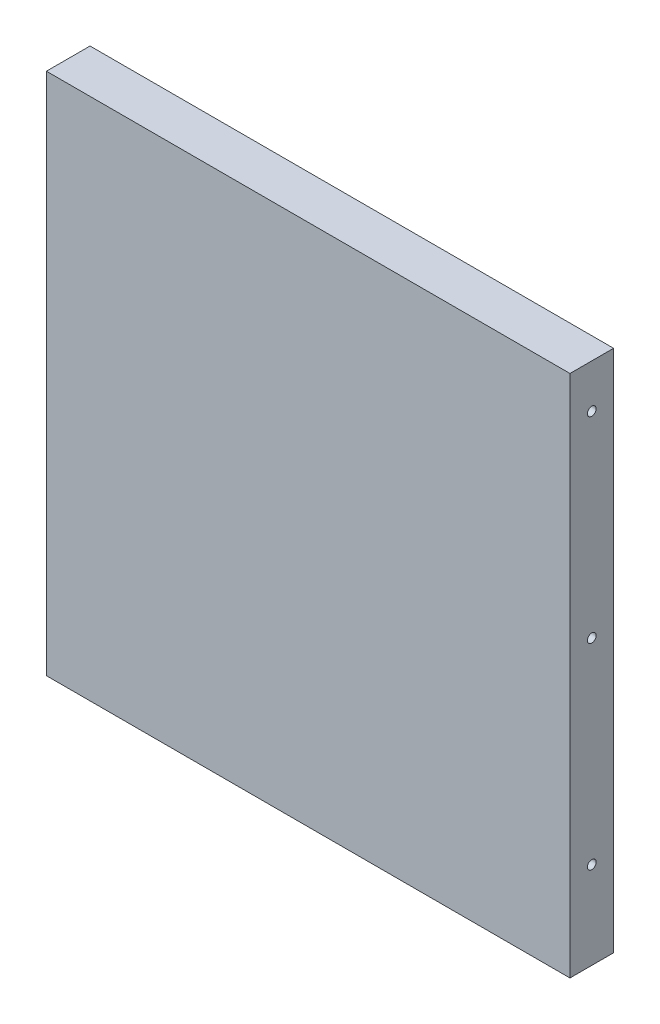
from build123d import *

# Parameters (mm, degrees)
SKETCH1_W                        = 304.8
SKETCH1_H                        = 25.4
BOSS_EXTRUDE1_DEPTH              = 152.4
F_1_4_20_TAPPED_HOLE1_AT_2_COUNT = 2
F_1_4_20_TAPPED_HOLE1_AT_2_PITCH = 114.3
F_1_4_20_TAPPED_HOLE1_AT_3_COUNT = 2
F_1_4_20_TAPPED_HOLE1_AT_3_PITCH = 228.6


with BuildPart() as part:
    # Sketch1 → Boss-Extrude1 (new, symmetric)
    with BuildSketch(Plane(origin=(0, 0, 0), x_dir=(1, 0, 0), z_dir=(0, 1, 0))):
        Rectangle(SKETCH1_W, SKETCH1_H)
    extrude(amount=BOSS_EXTRUDE1_DEPTH, both=True)

    # Sketch5 → 1/4-20 Tapped Hole1 (revolve, cut)
    with BuildSketch(Plane(origin=(152.4, 127, 0), x_dir=(0, 0, -1), z_dir=(0, 1, 0))):
        Polygon((0, 0), (0, 30.743816902), (2.5527, 29.21), (2.5527, 0), align=None)
    f_1_4_20_tapped_hole1 = revolve(axis=Axis((158.75, 127, 0), (-1, 0, 0)), mode=Mode.SUBTRACT)

    # 1/4-20 Tapped Hole1 at 2: 1/4-20 Tapped Hole1 ×2
    with Locations(*[(0, -i * F_1_4_20_TAPPED_HOLE1_AT_2_PITCH, 0) for i in range(1, F_1_4_20_TAPPED_HOLE1_AT_2_COUNT)]):
        add(f_1_4_20_tapped_hole1, mode=Mode.SUBTRACT)

    # 1/4-20 Tapped Hole1 at 3: 1/4-20 Tapped Hole1 ×2
    with Locations(*[(0, -i * F_1_4_20_TAPPED_HOLE1_AT_3_PITCH, 0) for i in range(1, F_1_4_20_TAPPED_HOLE1_AT_3_COUNT)]):
        add(f_1_4_20_tapped_hole1, mode=Mode.SUBTRACT)

    # Mirror1: 1/4-20 Tapped Hole1 across plane
    add(f_1_4_20_tapped_hole1.mirror(Plane(origin=(0, 0, 0), x_dir=(0, 0, 1), z_dir=(1, 0, 0))), mode=Mode.SUBTRACT)

    # Mirror1 copy 1 sketch → Mirror1 copy 1 (revolve, cut)
    with BuildSketch(Plane(origin=(-152.4, 12.7, 0), x_dir=(0, 0, -1), z_dir=(0, 1, 0))):
        Polygon((0, 0), (0, -30.743816902), (2.5527, -29.21), (2.5527, 0), align=None)
    revolve(axis=Axis((-158.75, 12.7, 0), (-1, 0, 0)), mode=Mode.SUBTRACT)

    # Mirror1 copy 2 sketch → Mirror1 copy 2 (revolve, cut)
    with BuildSketch(Plane(origin=(-152.4, -101.6, 0), x_dir=(0, 0, -1), z_dir=(0, 1, 0))):
        Polygon((0, 0), (0, -30.743816902), (2.5527, -29.21), (2.5527, 0), align=None)
    revolve(axis=Axis((-158.75, -101.6, 0), (-1, 0, 0)), mode=Mode.SUBTRACT)


solid = part.part
